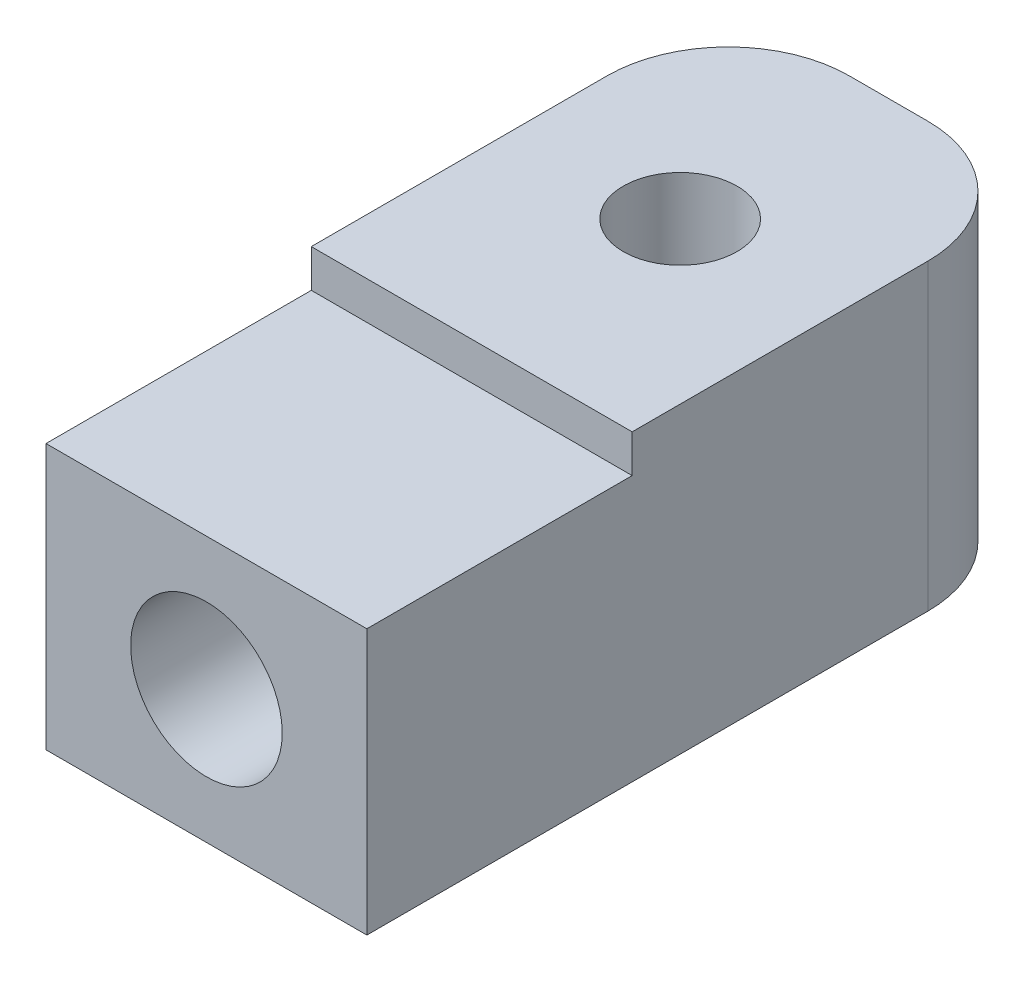
from build123d import *

# Parameters (mm, degrees)
SKETCH1_W           = 1058.297604825
SKETCH1_H           = 1375
BOSS_EXTRUDE4_DEPTH = 1000
SKETCH1_7_W         = 1058.297604825
SKETCH1_7_H         = 875
BOSS_EXTRUDE5_DEPTH = 875
SKETCH5_R           = 250
CUT_EXTRUDE1_DEPTH  = 1188
SKETCH6_R           = 187.5
CUT_EXTRUDE7_DEPTH  = 875
SKETCH7_R           = 237.5
CUT_EXTRUDE8_DEPTH  = 125
FILLET2_R           = 400


with BuildPart() as part:
    # Sketch1 → Boss-Extrude4 (new body)
    with BuildSketch(Plane(origin=(0, 0, 0), x_dir=(1, 0, 0), z_dir=(0, 1, 0))):
        with Locations((418.500975611, 243.415773734)):
            Rectangle(SKETCH1_W, SKETCH1_H)
    extrude(amount=BOSS_EXTRUDE4_DEPTH)

    # Sketch1<7> → Boss-Extrude5 (add)
    with BuildSketch(Plane(origin=(0, 0, 0), x_dir=(1, 0, 0), z_dir=(0, 1, 0))):
        with Locations((418.500975611, -881.584226266)):
            Rectangle(SKETCH1_7_W, SKETCH1_7_H)
    extrude(amount=BOSS_EXTRUDE5_DEPTH)

    # Sketch5 → Cut-Extrude1 (cut)
    with BuildSketch(Plane.XY.offset(1319.084226266)):
        with Locations((418.500975611, 437.5)):
            Circle(SKETCH5_R)
    extrude(amount=-CUT_EXTRUDE1_DEPTH, mode=Mode.SUBTRACT)

    # Sketch6 → Cut-Extrude7 (cut)
    with BuildSketch(Plane(origin=(0, 1000, 0), x_dir=(1, 0, 0), z_dir=(0, 1, 0))):
        with Locations((418.500975611, 243.415773734)):
            Circle(SKETCH6_R)
    extrude(amount=-CUT_EXTRUDE7_DEPTH, mode=Mode.SUBTRACT)

    # Sketch7 → Cut-Extrude8 (cut)
    with BuildSketch(Plane(origin=(0, 0, 0), x_dir=(-1, 0, 0), z_dir=(0, -1, 0))):
        with Locations((-418.500975611, 243.415773734)):
            Circle(SKETCH7_R)
    extrude(amount=-CUT_EXTRUDE8_DEPTH, mode=Mode.SUBTRACT)

    # Fillet2
    fillet2_edges = [part.edges().sort_by_distance(p)[0] for p in [
        (-110.647826802, 500, -930.915773734),
        (947.649778023, 500, -930.915773734),
    ]]
    fillet(fillet2_edges, radius=FILLET2_R)


solid = part.part
